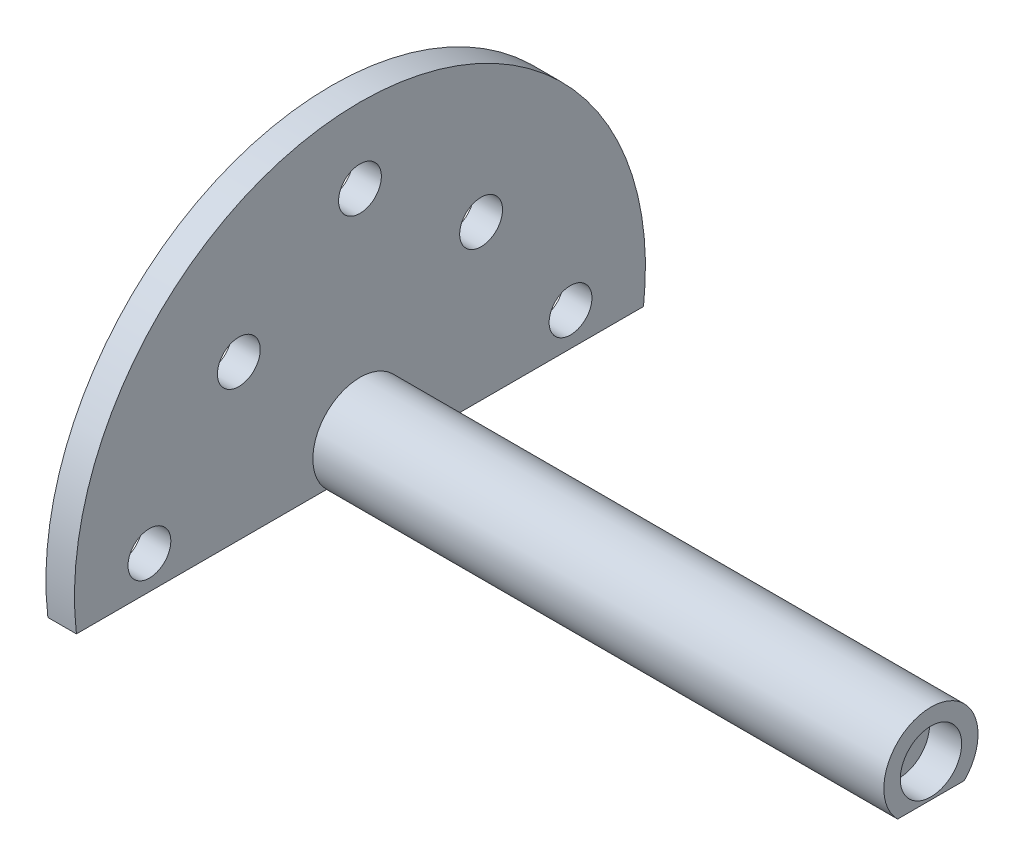
from build123d import *

# Parameters (mm, degrees)
SKETCH1_R           = 1.5
BOSS_EXTRUDE1_DEPTH = 2
BOSS_EXTRUDE2_START = 2
SKETCH1_3_W         = 4.666904756
SKETCH1_3_H         = 4.666904756
BOSS_EXTRUDE2_DEPTH = 40
SKETCH3_R           = 2.15
CUT_EXTRUDE1_DEPTH  = 2.25


with BuildPart() as part:
    # Sketch1 → Boss-Extrude1 (new body)
    with BuildSketch(Plane(origin=(0, 0, 0), x_dir=(0, 0, -1), z_dir=(1, 0, 0))):
        with BuildLine():
            Line((-19.86340857, -2.333452378), (19.86340857, -2.333452378))
            ThreePointArc((19.86340857, -2.333452378), (0, 20), (-19.86340857, -2.333452378))
        make_face()
        with Locations((-14.75, 0)):
            Circle(SKETCH1_R, mode=Mode.SUBTRACT)
        with Locations((14.75, 0)):
            Circle(SKETCH1_R, mode=Mode.SUBTRACT)
        with Locations((-8.485281374, 8.485281374)):
            Circle(SKETCH1_R, mode=Mode.SUBTRACT)
        with Locations((8.485281374, 8.485281374)):
            Circle(SKETCH1_R, mode=Mode.SUBTRACT)
        with Locations((0, 14.75)):
            Circle(SKETCH1_R, mode=Mode.SUBTRACT)
    extrude(amount=BOSS_EXTRUDE1_DEPTH)

    # Sketch1<3> → Boss-Extrude2 (add)
    with BuildSketch(Plane(origin=(0, 0, 0), x_dir=(0, 0, -1), z_dir=(1, 0, 0)).offset(BOSS_EXTRUDE2_START)):
        Rectangle(SKETCH1_3_W, SKETCH1_3_H)
        with BuildLine():
            Line((2.333452378, 2.333452378), (2.333452378, -2.333452378))
            ThreePointArc((2.333452378, -2.333452378), (3.048802457, -1.262855327), (3.3, 0))
            ThreePointArc((3.3, 0), (3.048802457, 1.262855327), (2.333452378, 2.333452378))
        make_face()
        with BuildLine():
            ThreePointArc((2.333452378, 2.333452378), (0, 3.3), (-2.333452378, 2.333452378))
            Line((-2.333452378, 2.333452378), (2.333452378, 2.333452378))
        make_face()
        with BuildLine():
            ThreePointArc((-2.333452378, 2.333452378), (-3.3, 0), (-2.333452378, -2.333452378))
            Line((-2.333452378, -2.333452378), (-2.333452378, 2.333452378))
        make_face()
    extrude(amount=BOSS_EXTRUDE2_DEPTH)

    # Sketch3 → Cut-Extrude1 (cut)
    with BuildSketch(Plane(origin=(42, 0, 0), x_dir=(0, 0, -1), z_dir=(1, 0, 0))):
        Circle(SKETCH3_R)
    extrude(amount=-CUT_EXTRUDE1_DEPTH, mode=Mode.SUBTRACT)


solid = part.part
